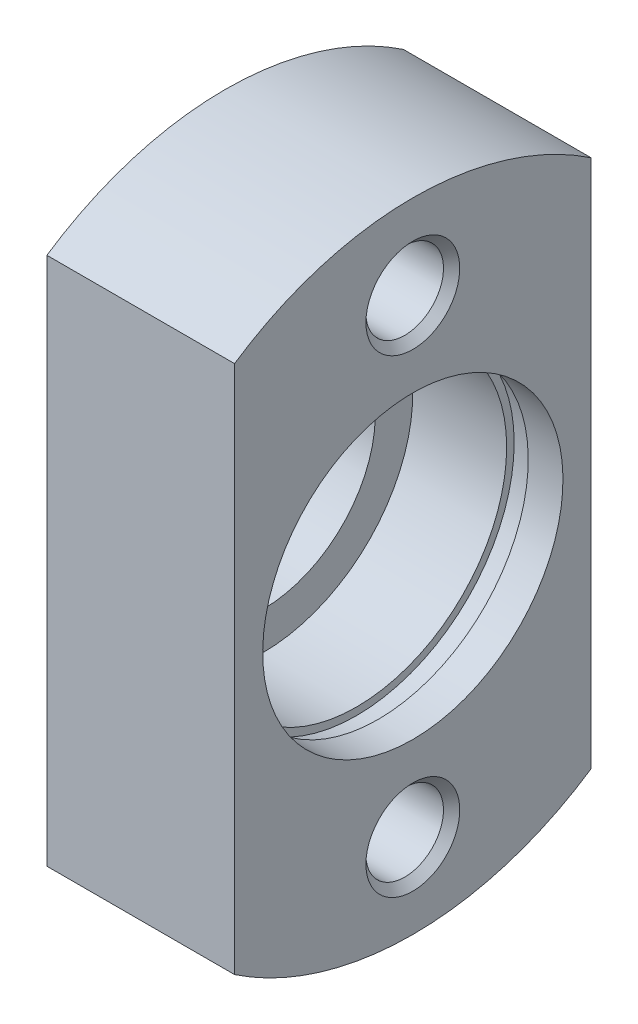
from build123d import *

# Parameters (mm, degrees)
BOSS_EXTRUDE1_DEPTH      = 5
BOSS_EXTRUDE1_DEPTH_BACK = 5
SKETCH3_W                = 1.15
SKETCH3_H                = 8.4


with BuildPart() as part:
    # Sketch1 → Boss-Extrude1 (new, two sides: drawn at the far end of the back side and taken through both)
    with BuildSketch(Plane(origin=(0, 0, 0), x_dir=(0, 0, -1), z_dir=(1, 0, 0)).offset(-BOSS_EXTRUDE1_DEPTH_BACK)):
        with BuildLine():
            Line((9.5, -14.09787218), (9.5, 14.09787218))
            ThreePointArc((9.5, 14.09787218), (0, 17), (-9.5, 14.09787218))
            Line((-9.5, 14.09787218), (-9.5, -14.09787218))
            ThreePointArc((-9.5, -14.09787218), (0, -17), (9.5, -14.09787218))
        make_face()
    extrude(amount=BOSS_EXTRUDE1_DEPTH + BOSS_EXTRUDE1_DEPTH_BACK)

    # Sketch2 → Cut-Revolve1 (revolve, cut)
    with BuildSketch(Plane.XY):
        Polygon((-5, 0), (-5, 6), (-3, 6), (-3, 8), (5, 8), (5, 0), align=None)
    revolve(axis=Axis((5, 0, 0), (-1, 0, 0)), mode=Mode.SUBTRACT)

    # Sketch3 → Cut-Revolve2 (revolve, cut)
    with BuildSketch(Plane.XY):
        with Locations((2.575, 4.2)):
            Rectangle(SKETCH3_W, SKETCH3_H)
    revolve(axis=Axis((3.15, 0, 0), (-1, 0, 0)), mode=Mode.SUBTRACT)

    # Sketch4 → Cut-Revolve3 (revolve, cut)
    with BuildSketch(Plane.XY):
        Polygon((-5, -12.5), (-5, -10), (-4.567, -10.433), (4.567, -10.433), (5, -10), (5, -12.5), align=None)
    revolve(axis=Axis((5, -12.5, 0), (-1, 0, 0)), mode=Mode.SUBTRACT)

    # Sketch5 → Cut-Revolve4 (revolve, cut)
    with BuildSketch(Plane.XY):
        Polygon((-5, 12.5), (-5, 15), (-4.567, 14.567), (4.567, 14.567), (5, 15), (5, 12.5), align=None)
    revolve(axis=Axis((5, 12.5, 0), (-1, 0, 0)), mode=Mode.SUBTRACT)


solid = part.part
